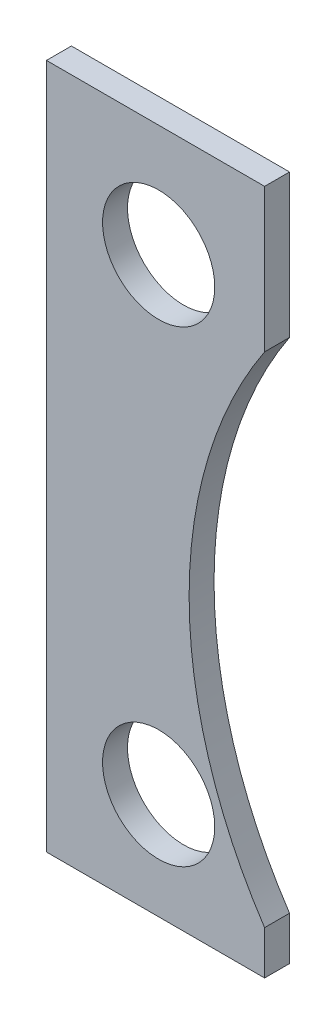
from build123d import *

# Parameters (mm, degrees)
BOSS_EXTRUDE1_DEPTH = 2
SKETCH2_R           = 9
CUT_EXTRUDE1_DEPTH  = 116.503246708


with BuildPart() as part:
    # Sketch1 → Boss-Extrude1 (new, symmetric)
    with BuildSketch(Plane.XY):
        with BuildLine():
            Line((0, 110), (35, 110))
            Line((35, 110), (35, 87))
            ThreePointArc((35, 87), (22.888974491, 47), (35, 7))
            Line((35, 7), (35, 0))
            Line((35, 0), (0, 0))
            Line((0, 0), (0, 110))
        make_face()
    extrude(amount=BOSS_EXTRUDE1_DEPTH, both=True)

    # Sketch2 → Cut-Extrude1 (cut, through all)
    with BuildSketch(Plane.XY.offset(2)):
        with Locations((18, 92)):
            Circle(SKETCH2_R)
        with Locations((18, 17)):
            Circle(SKETCH2_R)
    extrude(amount=-CUT_EXTRUDE1_DEPTH, mode=Mode.SUBTRACT)


solid = part.part
